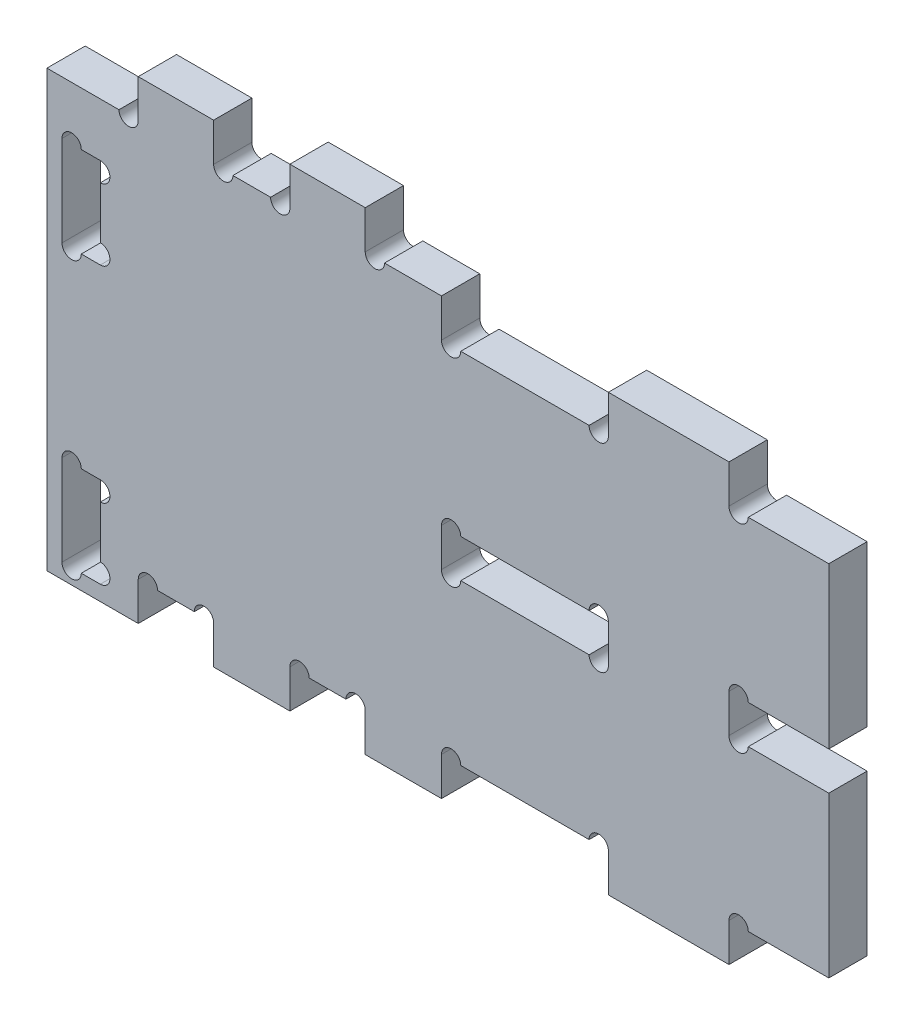
from build123d import *

# Parameters (mm, degrees)
SKETCH1_W           = 12.7
SKETCH1_H           = 30
SKETCH1_W_2         = 55.36
SKETCH1_H_2         = 12.7
BOSS_EXTRUDE1_DEPTH = 12.7
SKETCH3_W           = 25
SKETCH3_H           = 12.7
CUT_EXTRUDE2_DEPTH  = 300.216536308
SKETCH2_R           = 3.2
CUT_EXTRUDE1_DEPTH  = 300.216536308


with BuildPart() as part:
    # Sketch1 → Boss-Extrude1 (new body)
    with BuildSketch(Plane.XY):
        Polygon((221.23, 144.4), (221.23, 131.7), (254.34, 131.7), (254.34, 78.5), (221.23, 78.5), (221.23, 65.8), (254.34, 65.8), (254.34, 12.7), (221.23, 12.7), (221.23, 0), (181.23, 0), (181.23, 12.7), (125.87, 12.7), (125.87, 0), (-5, 0), (-5, 144.4), (0, 144.4), (25.29, 144.4), (25.29, 157.1), (50.29, 157.1), (50.29, 144.4), (75.58, 144.4), (75.58, 157.1), (100.58, 157.1), (100.58, 144.4), (125.87, 144.4), (125.87, 131.7), (181.23, 131.7), (181.23, 144.4), align=None)
        with Locations((6.35, 111.7)):
            Rectangle(SKETCH1_W, SKETCH1_H, mode=Mode.SUBTRACT)
        with Locations((6.35, 20)):
            Rectangle(SKETCH1_W, SKETCH1_H, mode=Mode.SUBTRACT)
        with Locations((153.55, 72.15)):
            Rectangle(SKETCH1_W_2, SKETCH1_H_2, mode=Mode.SUBTRACT)
    extrude(amount=BOSS_EXTRUDE1_DEPTH)

    # Sketch3 → Cut-Extrude2 (cut, through all)
    with BuildSketch(Plane.XY.offset(12.7)):
        with Locations((37.79, 6.35)):
            Rectangle(SKETCH3_W, SKETCH3_H)
        with Locations((88.08, 6.35)):
            Rectangle(SKETCH3_W, SKETCH3_H)
    extrude(amount=-CUT_EXTRUDE2_DEPTH, mode=Mode.SUBTRACT)

    # Sketch2 → Cut-Extrude1 (cut, through all)
    with BuildSketch(Plane.XY.offset(12.7)):
        with Locations((129.07, 131.7)):
            Circle(SKETCH2_R)
        with Locations((178.03, 131.7)):
            Circle(SKETCH2_R)
        with Locations((224.43, 131.7)):
            Circle(SKETCH2_R)
        with Locations((224.43, 78.5)):
            Circle(SKETCH2_R)
        with Locations((224.43, 65.8)):
            Circle(SKETCH2_R)
        with Locations((224.43, 12.7)):
            Circle(SKETCH2_R)
        with Locations((28.49, 12.7)):
            Circle(SKETCH2_R)
        with Locations((47.09, 12.7)):
            Circle(SKETCH2_R)
        with Locations((178.03, 12.7)):
            Circle(SKETCH2_R)
        with Locations((178.03, 65.8)):
            Circle(SKETCH2_R)
        with Locations((178.03, 78.5)):
            Circle(SKETCH2_R)
        with Locations((129.07, 78.5)):
            Circle(SKETCH2_R)
        with Locations((129.07, 65.8)):
            Circle(SKETCH2_R)
        with Locations((129.07, 12.7)):
            Circle(SKETCH2_R)
        with Locations((78.78, 12.7)):
            Circle(SKETCH2_R)
        with Locations((3.2, 126.7)):
            Circle(SKETCH2_R)
        with Locations((3.2, 96.7)):
            Circle(SKETCH2_R)
        with Locations((3.2, 35)):
            Circle(SKETCH2_R)
        with Locations((3.2, 5)):
            Circle(SKETCH2_R)
        with Locations((12.7, 8.2)):
            Circle(SKETCH2_R)
        with Locations((12.7, 31.8)):
            Circle(SKETCH2_R)
        with Locations((12.7, 99.9)):
            Circle(SKETCH2_R)
        with Locations((12.7, 123.5)):
            Circle(SKETCH2_R)
        with Locations((22.09, 144.4)):
            Circle(SKETCH2_R)
        with Locations((53.49, 144.4)):
            Circle(SKETCH2_R)
        with Locations((72.38, 144.4)):
            Circle(SKETCH2_R)
        with Locations((103.78, 144.4)):
            Circle(SKETCH2_R)
        with Locations((97.38, 12.7)):
            Circle(SKETCH2_R)
    extrude(amount=-CUT_EXTRUDE1_DEPTH, mode=Mode.SUBTRACT)


solid = part.part
